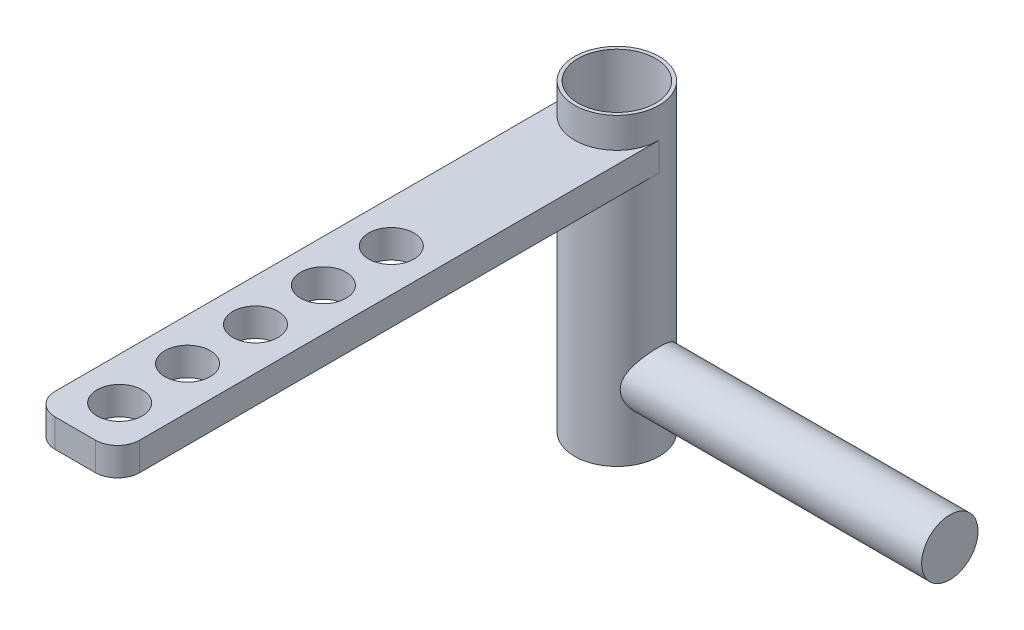
from build123d import *

# Parameters (mm, degrees)
SLEEVE_DEPTH       = 63.5
SLEEVE_DEPTH_BACK  = 5
SKETCH1_R          = 9.525
SKETCH2_W          = 19.05
SKETCH2_H          = 6.35
BRACKET_DEPTH      = 122
SKETCH4_R          = 5.1
BRACKET_HOLE_DEPTH = 138.86578845
SKETCH5_R          = 6.35
SHAFT_DEPTH        = 75
SKETCH6_R          = 8.73125
SLEEVE_HOLE_DEPTH  = 157.656471388
FILLET1_R          = 5


with BuildPart() as part:
    # Sketch1 → Sleeve (new, two sides: drawn at the far end of the back side and taken through both)
    with BuildSketch(Plane(origin=(0, 0, 0), x_dir=(1, 0, 0), z_dir=(0, 1, 0)).offset(-SLEEVE_DEPTH_BACK)):
        with Locations(Location((0, 0, 0), (0, 0, 270))):
            Circle(SKETCH1_R)
    extrude(amount=SLEEVE_DEPTH + SLEEVE_DEPTH_BACK)

    # Sketch2 → Bracket (add)
    with BuildSketch(Plane.XY):
        with Locations((0, 53.5)):
            Rectangle(SKETCH2_W, SKETCH2_H)
    extrude(amount=BRACKET_DEPTH)

    # Sketch4 → Bracket Hole (cut, through all)
    with BuildSketch(Plane(origin=(0, 0, 0), x_dir=(1, 0, 0), z_dir=(0, 1, 0))):
        with Locations(Location((0, -50.8, 0), (0, 0, 90))):
            Circle(SKETCH4_R)
        with Locations(Location((0, -66.1, 0), (0, 0, 90))):
            Circle(SKETCH4_R)
        with Locations(Location((0, -81.4, 0), (0, 0, 90))):
            Circle(SKETCH4_R)
        with Locations(Location((0, -96.7, 0), (0, 0, 90))):
            Circle(SKETCH4_R)
        with Locations(Location((0, -112, 0), (0, 0, 90))):
            Circle(SKETCH4_R)
    extrude(amount=BRACKET_HOLE_DEPTH, mode=Mode.SUBTRACT)

    # Sketch5 → Shaft (add)
    with BuildSketch(Plane(origin=(0, 0, 0), x_dir=(0, 0, -1), z_dir=(1, 0, 0))):
        with Locations(Location((0, 10, 0), (0, 0, 180))):
            Circle(SKETCH5_R)
    extrude(amount=SHAFT_DEPTH)

    # Sketch6 → Sleeve Hole (cut, through all)
    with BuildSketch(Plane(origin=(0, 0, 0), x_dir=(1, 0, 0), z_dir=(0, 1, 0))):
        with Locations(Location((0, 0, 0), (0, 0, 270))):
            Circle(SKETCH6_R)
    extrude(amount=SLEEVE_HOLE_DEPTH, mode=Mode.SUBTRACT)

    # Fillet1
    fillet1_edges = [part.edges().sort_by_distance(p)[0] for p in [
        (-9.525, 53.5, 122),
        (9.525, 53.5, 122),
    ]]
    fillet(fillet1_edges, radius=FILLET1_R)


solid = part.part
